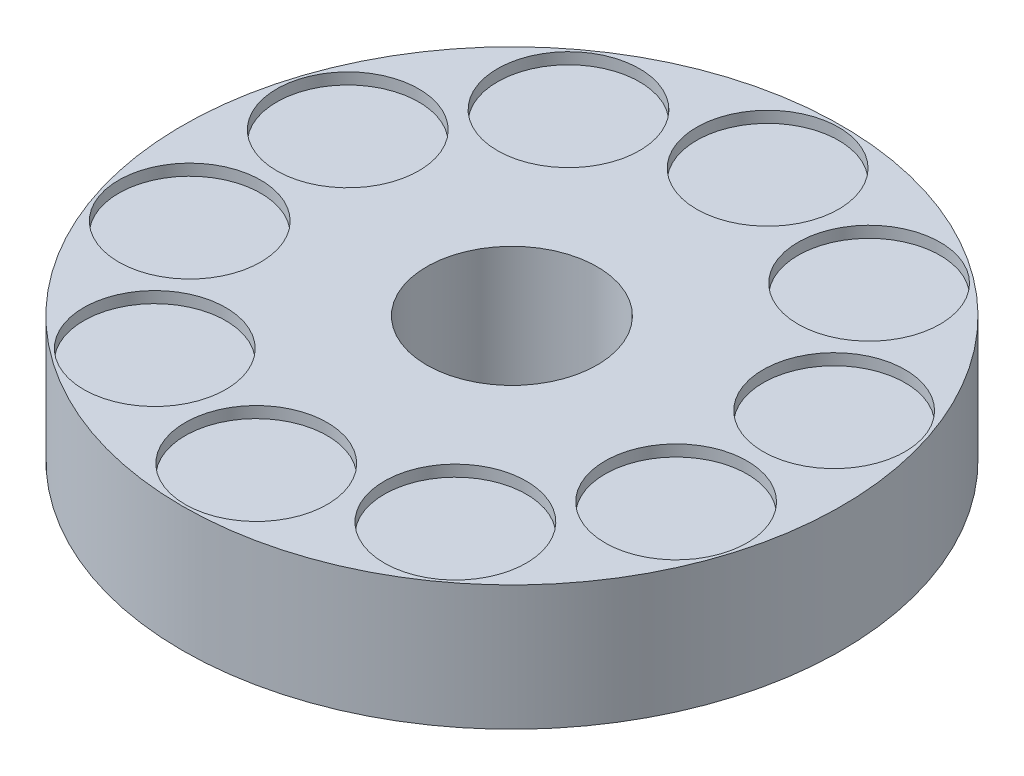
from build123d import *

# Parameters (mm, degrees)
SKETCH2_R           = 12.5
CUT_EXTRUDE1_DEPTH  = 2
BOSS_EXTRUDE1_DEPTH = 1.5
CIRPATTERN1_COUNT   = 6


with BuildPart() as part:
    # Sketch1 → Revolve1 (revolve)
    with BuildSketch(Plane(origin=(0, 0, 0), x_dir=(0, 0, -1), z_dir=(1, 0, 0))):
        Polygon((-45, 11), (-15, 11), (-15, -11), (-18, -11), (-18, 7), (-45, 7), (-55, 7), (-55, -11), (-58, -11), (-58, 11), align=None)
    revolve(axis=Axis((0, 42.640170011, 0), (0, -1, 0)))

    # Sketch2 → Cut-Extrude1 (cut)
    with BuildSketch(Plane(origin=(0, 11, 0), x_dir=(1, 0, 0), z_dir=(0, 1, 0))):
        with Locations(Location((0, 45, 0), (0, 0, 270))):
            Circle(SKETCH2_R)
        with Locations(Location((26.450336353, 36.405764747, 0), (0, 0, 270))):
            Circle(SKETCH2_R)
        with Locations(Location((42.797543233, 13.905764747, 0), (0, 0, 270))):
            Circle(SKETCH2_R)
        with Locations(Location((42.797543233, -13.905764747, 0), (0, 0, 270))):
            Circle(SKETCH2_R)
        with Locations(Location((26.450336353, -36.405764747, 0), (0, 0, 270))):
            Circle(SKETCH2_R)
        with Locations(Location((0, -45, 0), (0, 0, 270))):
            Circle(SKETCH2_R)
        with Locations(Location((-26.450336353, -36.405764747, 0), (0, 0, 270))):
            Circle(SKETCH2_R)
        with Locations(Location((-42.797543233, -13.905764747, 0), (0, 0, 270))):
            Circle(SKETCH2_R)
        with Locations(Location((-42.797543233, 13.905764747, 0), (0, 0, 270))):
            Circle(SKETCH2_R)
        with Locations(Location((-26.450336353, 36.405764747, 0), (0, 0, 270))):
            Circle(SKETCH2_R)
    extrude(amount=-CUT_EXTRUDE1_DEPTH, mode=Mode.SUBTRACT)

    # Sketch3 → Boss-Extrude1 (add, symmetric)
    with BuildSketch(Plane(origin=(0, 0, 0), x_dir=(0, 0, -1), z_dir=(1, 0, 0))):
        Polygon((-16.62069533, -11), (-16.62069533, 9), (-31.62069533, 9), align=None)
    boss_extrude1 = extrude(amount=BOSS_EXTRUDE1_DEPTH, both=True)

    # CirPattern1: Boss-Extrude1 ×6 about axis
    cirpattern1_axis = Axis((0, 0, 0), (0, 1, 0))
    for i in range(1, CIRPATTERN1_COUNT):
        add(boss_extrude1.rotate(cirpattern1_axis, i * 360 / CIRPATTERN1_COUNT))


solid = part.part
